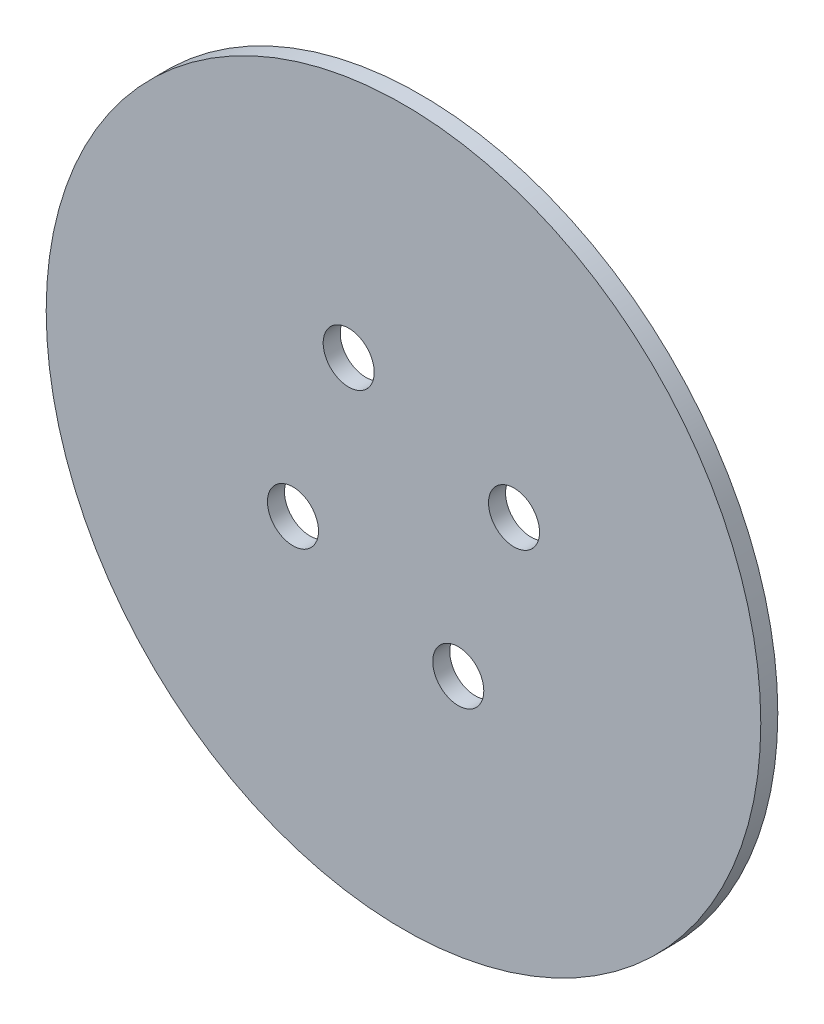
from build123d import *

# Parameters (mm, degrees)
SKETCH1_R           = 21
BOSS_EXTRUDE1_DEPTH = 1
SKETCH2_R           = 1.5
CUT_EXTRUDE1_DEPTH  = 30.715315916


with BuildPart() as part:
    # Sketch1 → Boss-Extrude1 (new body)
    with BuildSketch(Plane.XY):
        Circle(SKETCH1_R)
    extrude(amount=BOSS_EXTRUDE1_DEPTH)

    # Sketch2 → Cut-Extrude1 (cut, through all)
    with BuildSketch(Plane.XY.offset(1)):
        with Locations((-3.219640923, 6.495876564)):
            Circle(SKETCH2_R)
        with Locations((6.495876564, 3.219640923)):
            Circle(SKETCH2_R)
        with Locations((-6.495876564, -3.219640923)):
            Circle(SKETCH2_R)
        with Locations((3.219640923, -6.495876564)):
            Circle(SKETCH2_R)
    extrude(amount=-CUT_EXTRUDE1_DEPTH, mode=Mode.SUBTRACT)


solid = part.part
